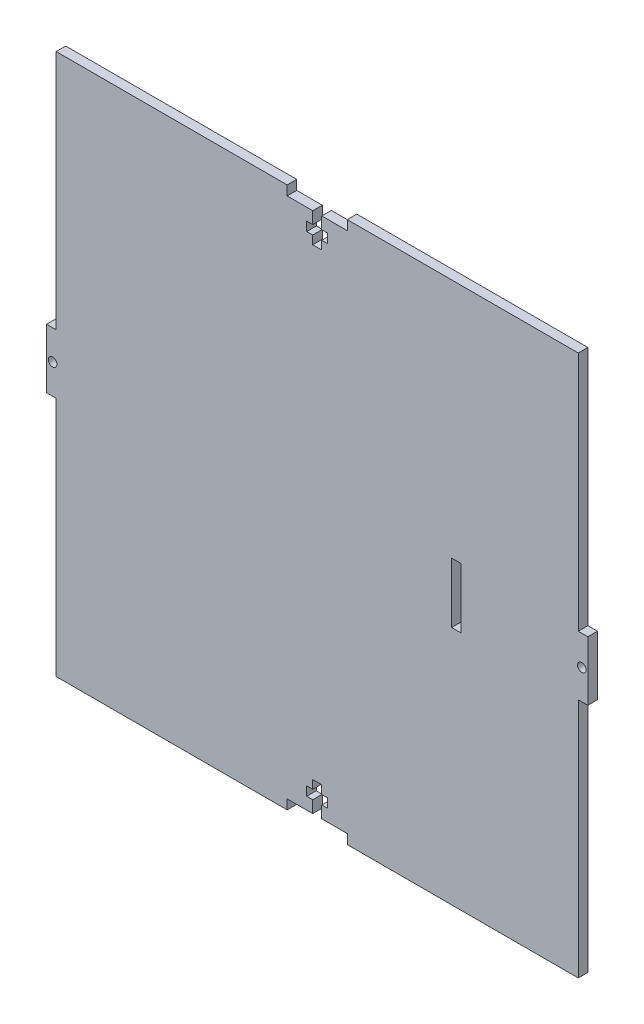
from build123d import *

# Parameters (mm, degrees)
SKETCH3_W           = 180
SKETCH3_H           = 180
SKETCH3_W_2         = 3.18
SKETCH3_H_2         = 20
BOSS_EXTRUDE1_DEPTH = 3.18
CUT_EXTRUDE1_DEPTH  = 128.318939675
SKETCH5_R           = 1.436023081
SKETCH5_W           = 3.18
SKETCH5_H           = 80.125
CUT_EXTRUDE2_DEPTH  = 128.318939675


with BuildPart() as part:
    # Sketch3 → Boss-Extrude1 (new body)
    with BuildSketch(Plane.XY):
        Rectangle(SKETCH3_W, SKETCH3_H)
        with Locations((46.269729843, -0.125)):
            Rectangle(SKETCH3_W_2, SKETCH3_H_2, mode=Mode.SUBTRACT)
    extrude(amount=BOSS_EXTRUDE1_DEPTH)

    # Sketch4 → Cut-Extrude1 (cut, through all)
    with BuildSketch(Plane.XY.offset(3.18)):
        Polygon((1.5, 86.82), (10, 86.82), (10, 90), (-10, 90), (-10, 86.82), (-1.5, 86.82), (-1.5, 82.82), (-3.5, 82.82), (-3.5, 79.82), (-1.5, 79.82), (-1.5, 77), (1.5, 77), (1.5, 79.82), (3.5, 79.82), (3.5, 82.82), (1.5, 82.82), align=None)
        Polygon((1.5, -79.82), (1.5, -77), (-1.5, -77), (-1.5, -79.82), (-3.5, -79.82), (-3.5, -82.82), (-1.5, -82.82), (-1.5, -86.82), (-10, -86.82), (-10, -90), (10, -90), (10, -86.82), (1.5, -86.82), (1.5, -82.82), (3.5, -82.82), (3.5, -79.82), align=None)
    extrude(amount=-CUT_EXTRUDE1_DEPTH, mode=Mode.SUBTRACT)

    # Sketch5 → Cut-Extrude2 (cut, through all)
    with BuildSketch(Plane.XY.offset(3.18)):
        with Locations((-88, 0)):
            Circle(SKETCH5_R)
        with Locations((88, 0)):
            Circle(SKETCH5_R)
        with Locations((-88.41, 49.9375)):
            Rectangle(SKETCH5_W, SKETCH5_H)
        with Locations((-88.41, -49.9375)):
            Rectangle(SKETCH5_W, SKETCH5_H)
        with Locations((88.41, -49.9375)):
            Rectangle(SKETCH5_W, SKETCH5_H)
        with Locations((88.41, 49.9375)):
            Rectangle(SKETCH5_W, SKETCH5_H)
    extrude(amount=-CUT_EXTRUDE2_DEPTH, mode=Mode.SUBTRACT)


solid = part.part
